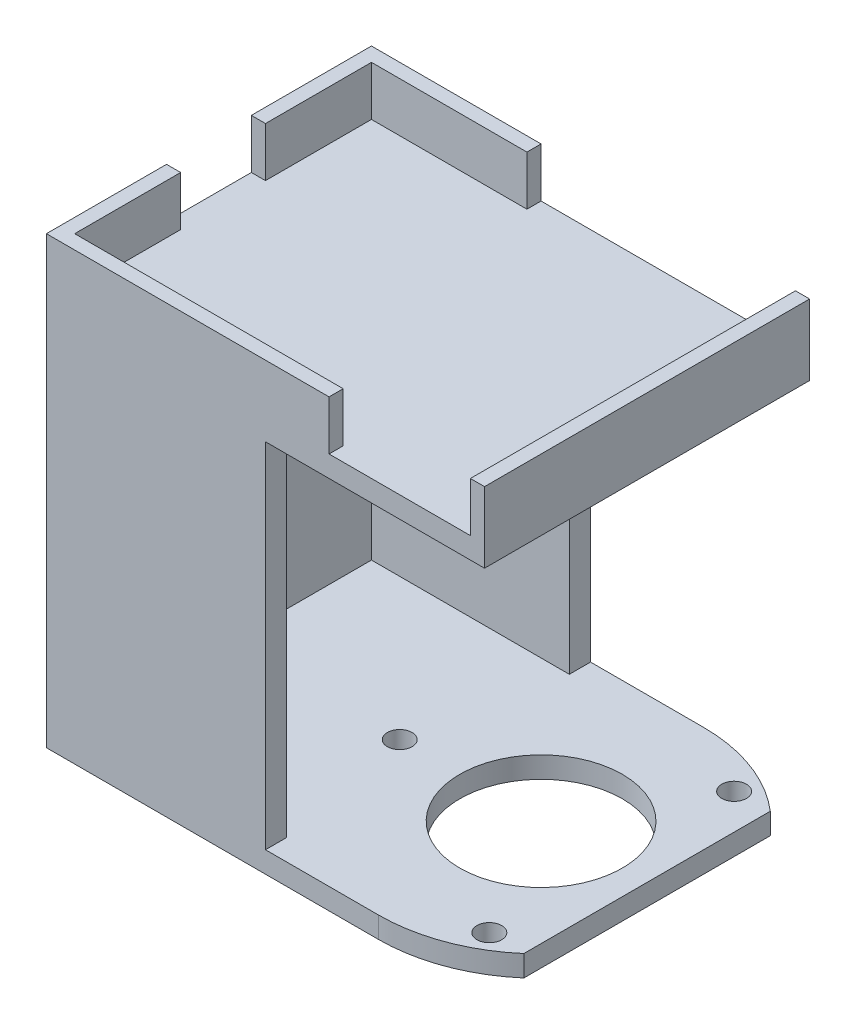
from build123d import *

# Parameters (mm, degrees)
SKETCH_1_W          = 62
SKETCH_1_H          = 46
EXTRUDE_1_DEPTH     = 10
SKETCH_2_W          = 58
SKETCH_2_H          = 42
CUT_EXTRUDE_1_DEPTH = 7
CUT_EXTRUDE_2_REACH = 68.88
SKETCH_3_W          = 12
SKETCH_3_H          = 14
CUT_EXTRUDE_3_REACH = 56.745
SKETCH_5_W          = 36
SKETCH_5_H          = 7
CUT_EXTRUDE_4_REACH = 56.745
SKETCH_6_W          = 20
SKETCH_6_H          = 7
EXTRUDE_2_DEPTH     = 50
SKETCH_9_W          = 62
SKETCH_9_H          = 46
EXTRUDE_3_DEPTH     = 3
CUT_EXTRUDE_5_REACH = 75.885
SKETCH_10_R         = 1.75


with BuildPart() as part:
    # 草图1 → 凸台-拉伸1 (new body)
    with BuildSketch(Plane(origin=(0, 0, 0), x_dir=(1, 0, 0), z_dir=(0, 1, 0))):
        Rectangle(SKETCH_1_W, SKETCH_1_H)
    extrude(amount=EXTRUDE_1_DEPTH)

    # 草图2 → 切除-拉伸1 (cut)
    with BuildSketch(Plane(origin=(0, 10, 0), x_dir=(1, 0, 0), z_dir=(0, 1, 0))):
        Rectangle(SKETCH_2_W, SKETCH_2_H)
    extrude(amount=-CUT_EXTRUDE_1_DEPTH, mode=Mode.SUBTRACT)

    # 草图3 → 切除-拉伸2 (cut, up to next)
    with BuildSketch(Plane.ZY.offset(31), mode=Mode.PRIVATE) as cut_extrude_2_sk1:
        with Locations((0, 10)):
            Rectangle(SKETCH_3_W, SKETCH_3_H)
    cut_extrude_2_tool1 = extrude(cut_extrude_2_sk1.sketch, amount=-CUT_EXTRUDE_2_REACH, mode=Mode.PRIVATE) & part.part
    add(cut_extrude_2_tool1.solids().sort_by_distance((-31, 10, 0))[0], mode=Mode.SUBTRACT)

    # 草图5 → 切除-拉伸3 (cut, up to next)
    with BuildSketch(Plane.XY.offset(-21), mode=Mode.PRIVATE) as cut_extrude_3_sk1:
        with Locations((11, 6.5)):
            Rectangle(SKETCH_5_W, SKETCH_5_H)
    cut_extrude_3_tool1 = extrude(cut_extrude_3_sk1.sketch, amount=-CUT_EXTRUDE_3_REACH, mode=Mode.PRIVATE) & part.part
    add(cut_extrude_3_tool1.solids().sort_by_distance((11, 6.5, -21))[0], mode=Mode.SUBTRACT)

    # 草图6 → 切除-拉伸4 (cut, up to next)
    with BuildSketch(Plane(origin=(0, 0, 21), x_dir=(-1, 0, 0), z_dir=(0, 0, -1)), mode=Mode.PRIVATE) as cut_extrude_4_sk1:
        with Locations((-19, 6.5)):
            Rectangle(SKETCH_6_W, SKETCH_6_H)
    cut_extrude_4_tool1 = extrude(cut_extrude_4_sk1.sketch, amount=-CUT_EXTRUDE_4_REACH, mode=Mode.PRIVATE) & part.part
    add(cut_extrude_4_tool1.solids().sort_by_distance((19, 6.5, 21))[0], mode=Mode.SUBTRACT)

    # 草图8 → 凸台-拉伸2 (add)
    with BuildSketch(Plane.XZ):
        Polygon((0, -23), (0, -20), (-28, -20), (-28, 20), (0, 20), (0, 23), (-31, 23), (-31, -23), align=None)
    extrude(amount=EXTRUDE_2_DEPTH)

    # 草图9 → 凸台-拉伸3 (add)
    with BuildSketch(Plane.XZ.offset(50)):
        Rectangle(SKETCH_9_W, SKETCH_9_H)
    extrude(amount=EXTRUDE_3_DEPTH)

    # 草图10 → 切除-拉伸5 (cut, up to next)
    with BuildSketch(Plane.XZ.offset(53), mode=Mode.PRIVATE) as cut_extrude_5_sk1:
        with BuildLine():
            Line((31, 17.435595774), (31, 23))
            Line((31, 23), (16, 23))
            ThreePointArc((16, 23), (23.999415516, 21.564075482), (31, 17.435595774))
        make_face()
    cut_extrude_5_tool1 = extrude(cut_extrude_5_sk1.sketch, amount=-CUT_EXTRUDE_5_REACH, mode=Mode.PRIVATE) & part.part
    # 草图10 → 切除-拉伸5 (cut, up to next)
    with BuildSketch(Plane.XZ.offset(53), mode=Mode.PRIVATE) as cut_extrude_5_sk2:
        with BuildLine():
            ThreePointArc((31, -17.435595774), (23.999415516, -21.564075482), (16, -23))
            Line((16, -23), (31, -23))
            Line((31, -23), (31, -17.435595774))
        make_face()
    cut_extrude_5_tool2 = extrude(cut_extrude_5_sk2.sketch, amount=-CUT_EXTRUDE_5_REACH, mode=Mode.PRIVATE) & part.part
    # 草图10 → 切除-拉伸5 (cut, up to next)
    with BuildSketch(Plane.XZ.offset(53), mode=Mode.PRIVATE) as cut_extrude_5_sk3:
        with Locations(Location((26, -17.320508076, 0), (0, 0, 270))):
            Circle(SKETCH_10_R)
    cut_extrude_5_tool3 = extrude(cut_extrude_5_sk3.sketch, amount=-CUT_EXTRUDE_5_REACH, mode=Mode.PRIVATE) & part.part
    # 草图10 → 切除-拉伸5 (cut, up to next)
    with BuildSketch(Plane.XZ.offset(53), mode=Mode.PRIVATE) as cut_extrude_5_sk4:
        with Locations(Location((26, 17.320508076, 0), (0, 0, 270))):
            Circle(SKETCH_10_R)
    cut_extrude_5_tool4 = extrude(cut_extrude_5_sk4.sketch, amount=-CUT_EXTRUDE_5_REACH, mode=Mode.PRIVATE) & part.part
    # 草图10 → 切除-拉伸5 (cut, up to next)
    with BuildSketch(Plane.XZ.offset(53), mode=Mode.PRIVATE) as cut_extrude_5_sk5:
        with BuildLine():
            ThreePointArc((27.5, 0), (24.131727984, 8.131727984), (16, 11.5))
            Line((16, 11.5), (16, -11.5))
            ThreePointArc((16, -11.5), (24.131727984, -8.131727984), (27.5, 0))
        make_face()
    cut_extrude_5_tool5 = extrude(cut_extrude_5_sk5.sketch, amount=-CUT_EXTRUDE_5_REACH, mode=Mode.PRIVATE) & part.part
    # 草图10 → 切除-拉伸5 (cut, up to next)
    with BuildSketch(Plane.XZ.offset(53), mode=Mode.PRIVATE) as cut_extrude_5_sk6:
        with BuildLine():
            Line((16, -11.5), (16, 11.5))
            ThreePointArc((16, 11.5), (4.5, 0), (16, -11.5))
        make_face()
    cut_extrude_5_tool6 = extrude(cut_extrude_5_sk6.sketch, amount=-CUT_EXTRUDE_5_REACH, mode=Mode.PRIVATE) & part.part
    # 草图10 → 切除-拉伸5 (cut, up to next)
    with BuildSketch(Plane.XZ.offset(53), mode=Mode.PRIVATE) as cut_extrude_5_sk7:
        with BuildLine():
            ThreePointArc((27.5, 0), (24.131727984, 8.131727984), (16, 11.5))
            Line((16, 11.5), (16, -11.5))
            ThreePointArc((16, -11.5), (24.131727984, -8.131727984), (27.5, 0))
        make_face()
    cut_extrude_5_tool7 = extrude(cut_extrude_5_sk7.sketch, amount=-CUT_EXTRUDE_5_REACH, mode=Mode.PRIVATE) & part.part
    # 草图10 → 切除-拉伸5 (cut, up to next)
    with BuildSketch(Plane.XZ.offset(53), mode=Mode.PRIVATE) as cut_extrude_5_sk8:
        with BuildLine():
            Line((16, -11.5), (16, 11.5))
            ThreePointArc((16, 11.5), (4.5, 0), (16, -11.5))
        make_face()
    cut_extrude_5_tool8 = extrude(cut_extrude_5_sk8.sketch, amount=-CUT_EXTRUDE_5_REACH, mode=Mode.PRIVATE) & part.part
    # 草图10 → 切除-拉伸5 (cut, up to next)
    with BuildSketch(Plane.XZ.offset(53), mode=Mode.PRIVATE) as cut_extrude_5_sk9:
        with Locations(Location((-4, 0, 0), (0, 0, 270))):
            Circle(SKETCH_10_R)
    cut_extrude_5_tool9 = extrude(cut_extrude_5_sk9.sketch, amount=-CUT_EXTRUDE_5_REACH, mode=Mode.PRIVATE) & part.part
    add(cut_extrude_5_tool1.solids().sort_by_distance((27.346788, -53, 21.372088))[0], mode=Mode.SUBTRACT)
    add(cut_extrude_5_tool2.solids().sort_by_distance((27.346788, -53, -21.372088))[0], mode=Mode.SUBTRACT)
    add(cut_extrude_5_tool3.solids().sort_by_distance((26, -53, -17.320508))[0], mode=Mode.SUBTRACT)
    add(cut_extrude_5_tool4.solids().sort_by_distance((26, -53, 17.320508))[0], mode=Mode.SUBTRACT)
    add(cut_extrude_5_tool5.solids().sort_by_distance((20.880752, -53, 0))[0], mode=Mode.SUBTRACT)
    add(cut_extrude_5_tool6.solids().sort_by_distance((11.119248, -53, 0))[0], mode=Mode.SUBTRACT)
    add(cut_extrude_5_tool7.solids().sort_by_distance((20.880752, -53, 0))[0], mode=Mode.SUBTRACT)
    add(cut_extrude_5_tool8.solids().sort_by_distance((11.119248, -53, 0))[0], mode=Mode.SUBTRACT)
    add(cut_extrude_5_tool9.solids().sort_by_distance((-4, -53, 0))[0], mode=Mode.SUBTRACT)


solid = part.part
